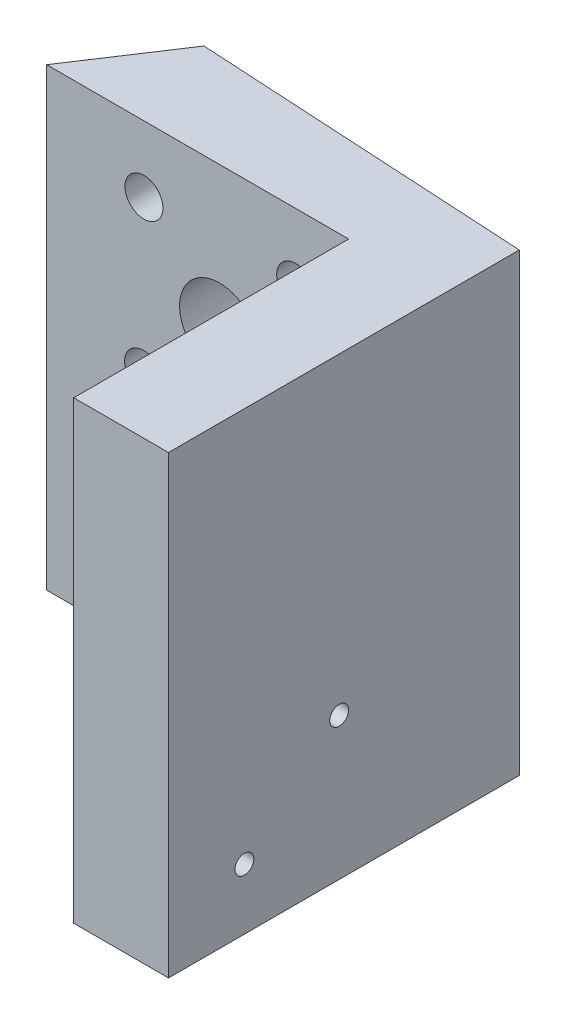
from build123d import *

# Parameters (mm, degrees)
SKETCH1_W           = 41.85
SKETCH1_H           = 10
SKETCH1_W_2         = 10
SKETCH1_H_2         = 29
BOSS_EXTRUDE1_DEPTH = 48
CUT_EXTRUDE1_DEPTH  = 48
SKETCH4_R           = 2
SKETCH4_R_2         = 4.2
CUT_EXTRUDE2_DEPTH  = 48
CUT_EXTRUDE3_DEPTH  = 48
SKETCH6_R           = 1
CUT_EXTRUDE4_DEPTH  = 2
SKETCH7_R           = 1
CUT_EXTRUDE5_DEPTH  = 1


with BuildPart() as part:
    # Sketch1 → Boss-Extrude1 (new body)
    with BuildSketch(Plane(origin=(0, 0, 0), x_dir=(1, 0, 0), z_dir=(0, 1, 0))):
        with Locations((-10.925, 5)):
            Rectangle(SKETCH1_W, SKETCH1_H)
        with Locations((5, -14.5)):
            Rectangle(SKETCH1_W_2, SKETCH1_H_2)
    extrude(amount=BOSS_EXTRUDE1_DEPTH)

    # Sketch3 → Cut-Extrude1 (cut)
    with BuildSketch(Plane(origin=(0, 48, 0), x_dir=(1, 0, 0), z_dir=(0, 1, 0))):
        Polygon((-31.85, 10), (-25.26317425, 10), (-31.85, 0), align=None)
    extrude(amount=-CUT_EXTRUDE1_DEPTH, mode=Mode.SUBTRACT)

    # Sketch4 → Cut-Extrude2 (cut)
    with BuildSketch(Plane.XY):
        with Locations((-5.589559388, 40.980827232)):
            Circle(SKETCH4_R)
        with Locations((-5.629681083, 24.979051073)):
            Circle(SKETCH4_R)
        with Locations((-21.591335547, 41.020948927)):
            Circle(SKETCH4_R)
        with Locations((-21.631457243, 25.019172768)):
            Circle(SKETCH4_R)
        with Locations((-13.629681083, 32.979051073)):
            Circle(SKETCH4_R_2)
    extrude(amount=-CUT_EXTRUDE2_DEPTH, mode=Mode.SUBTRACT)

    # Sketch5 → Cut-Extrude3 (cut)
    with BuildSketch(Plane(origin=(0, 48, 0), x_dir=(1, 0, 0), z_dir=(0, 1, 0))):
        Polygon((-25.26317425, 10), (10, 8), (10, 10), align=None)
    extrude(amount=-CUT_EXTRUDE3_DEPTH, mode=Mode.SUBTRACT)

    # Sketch6 → Cut-Extrude4 (cut)
    with BuildSketch(Plane(origin=(10, 0, 0), x_dir=(0, 0, -1), z_dir=(1, 0, 0))):
        with Locations((-21, 6.391948522)):
            Circle(SKETCH6_R)
        with Locations((-11, 15)):
            Circle(SKETCH6_R)
    extrude(amount=-CUT_EXTRUDE4_DEPTH, mode=Mode.SUBTRACT)

    # Sketch7 → Cut-Extrude5 (cut)
    with BuildSketch(Plane(origin=(0.484340621, 0, -8.539693864), x_dir=(-0.9983954953921488, 0, -0.056625389894163713), z_dir=(0.056625389894163713, 0, -0.9983954953921488))):
        with Locations((10.469048165, 7)):
            Circle(SKETCH7_R)
    extrude(amount=-CUT_EXTRUDE5_DEPTH, mode=Mode.SUBTRACT)


solid = part.part
